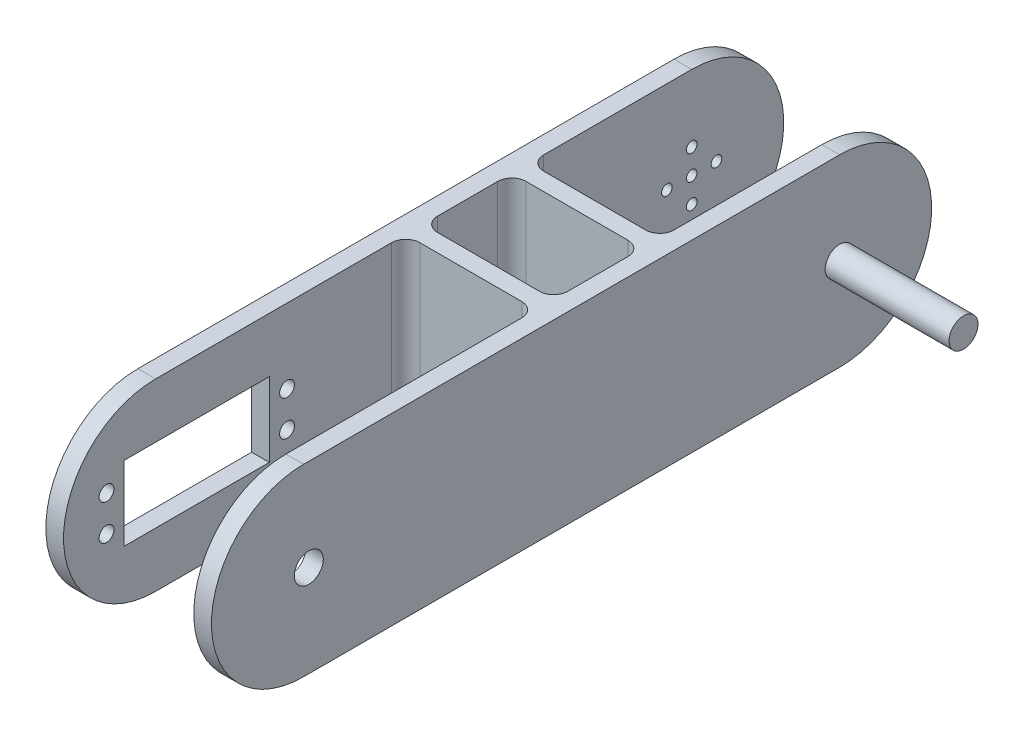
from build123d import *

# Parameters (mm, degrees)
BOSS_EXTRUDE3_DEPTH = 5
SKETCH4_R           = 1.5
CUT_EXTRUDE1_DEPTH  = 70
SKETCH5_R           = 2.1
SKETCH5_W           = 41
SKETCH5_H           = 21
CUT_EXTRUDE2_DEPTH  = 10
SKETCH6_W           = 5
SKETCH6_H           = 52
BOSS_EXTRUDE4_DEPTH = 36.8
BOSS_EXTRUDE5_DEPTH = 5
SKETCH8_R           = 4.1
BOSS_EXTRUDE6_DEPTH = 40
SKETCH10_R          = 4.1
CUT_EXTRUDE5_DEPTH  = 25
FILLET2_R           = 4


with BuildPart() as part:
    # Sketch3 → Boss-Extrude3 (new body)
    with BuildSketch(Plane(origin=(0, 0, 0), x_dir=(0, 0, -1), z_dir=(1, 0, 0))):
        with BuildLine():
            Line((-75.75, 26), (75.75, 26))
            ThreePointArc((75.75, 26), (101.75, 0), (75.75, -26))
            Line((75.75, -26), (-75.75, -26))
            ThreePointArc((-75.75, -26), (-101.75, 0), (-75.75, 26))
        make_face()
    extrude(amount=BOSS_EXTRUDE3_DEPTH)

    # Sketch4 → Cut-Extrude1 (cut)
    with BuildSketch(Plane.ZY):
        with Locations((-75.75, 0)):
            Circle(SKETCH4_R)
        with Locations((-75.75, 7)):
            Circle(SKETCH4_R)
        with Locations((-68.75, 0)):
            Circle(SKETCH4_R)
        with Locations((-75.75, -7)):
            Circle(SKETCH4_R)
        with Locations((-82.75, 0)):
            Circle(SKETCH4_R)
    extrude(amount=-CUT_EXTRUDE1_DEPTH, mode=Mode.SUBTRACT)

    # Sketch5 → Cut-Extrude2 (cut)
    with BuildSketch(Plane.ZY):
        with Locations((89.6, 5)):
            Circle(SKETCH5_R)
        with Locations(Location((89.6, -5, 0), (0, 0, 180))):
            Circle(SKETCH5_R)
        with Locations((38.6, -5)):
            Circle(SKETCH5_R)
        with Locations(Location((38.6, 5, 0), (0, 0, 180))):
            Circle(SKETCH5_R)
        with Locations((64.1, 0)):
            Rectangle(SKETCH5_W, SKETCH5_H)
    extrude(amount=-CUT_EXTRUDE2_DEPTH, mode=Mode.SUBTRACT)

    # Sketch6 → Boss-Extrude4 (add)
    with BuildSketch(Plane(origin=(5, 0, 0), x_dir=(0, 0, -1), z_dir=(1, 0, 0))):
        with Locations((27.431638641, 0)):
            Rectangle(SKETCH6_W, SKETCH6_H)
        with Locations((-2.568361359, 0)):
            Rectangle(SKETCH6_W, SKETCH6_H)
    extrude(amount=BOSS_EXTRUDE4_DEPTH)

    # Sketch7 → Boss-Extrude5 (add)
    with BuildSketch(Plane(origin=(41.8, 0, 0), x_dir=(0, 0, -1), z_dir=(1, 0, 0))):
        with BuildLine():
            Line((-75.75, 26), (75.75, 26))
            ThreePointArc((75.75, 26), (101.75, 0), (75.75, -26))
            Line((75.75, -26), (-75.75, -26))
            ThreePointArc((-75.75, -26), (-101.75, 0), (-75.75, 26))
        make_face()
    extrude(amount=BOSS_EXTRUDE5_DEPTH)

    # Sketch8 → Boss-Extrude6 (add)
    with BuildSketch(Plane.ZY.offset(-41.8)):
        with Locations((-75.75, 0)):
            Circle(SKETCH8_R)
    extrude(amount=-BOSS_EXTRUDE6_DEPTH)

    # Sketch10 → Cut-Extrude5 (cut)
    with BuildSketch(Plane(origin=(46.8, 0, 0), x_dir=(0, 0, -1), z_dir=(1, 0, 0))):
        with Locations((-74.25, 0)):
            Circle(SKETCH10_R)
    extrude(amount=-CUT_EXTRUDE5_DEPTH, mode=Mode.SUBTRACT)

    # Fillet2
    fillet2_edges = [part.edges().sort_by_distance(p)[0] for p in [
        (41.8, 0, 5.068361359),
        (41.8, 0, 0.068361359),
        (5, 0, -29.931638641),
        (5, 0, -24.931638641),
        (41.8, 0, -29.931638641),
        (41.8, 0, -24.931638641),
        (5, 0, 5.068361359),
        (5, 0, 0.068361359),
    ]]
    fillet(fillet2_edges, radius=FILLET2_R)


solid = part.part
